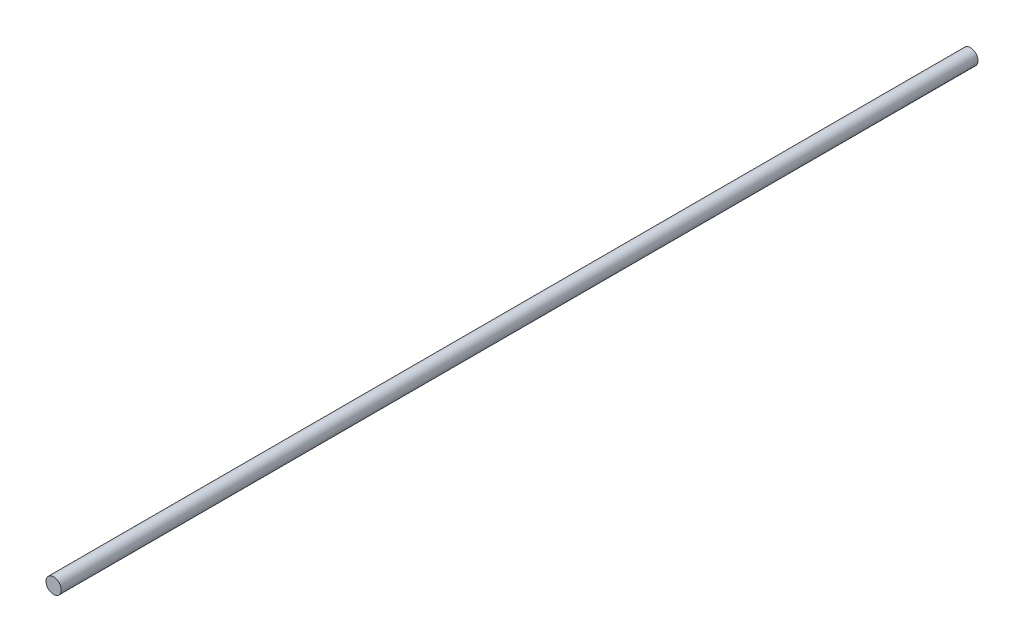
from build123d import *

# Parameters (mm, degrees)
SKIZZE1_R                       = 4
AUFSATZ_LINEAR_AUSTRAGEN1_DEPTH = 480


with BuildPart() as part:
    # Skizze1 → Aufsatz-Linear austragen1 (new body)
    with BuildSketch(Plane.XY):
        Circle(SKIZZE1_R)
    extrude(amount=AUFSATZ_LINEAR_AUSTRAGEN1_DEPTH)


solid = part.part
